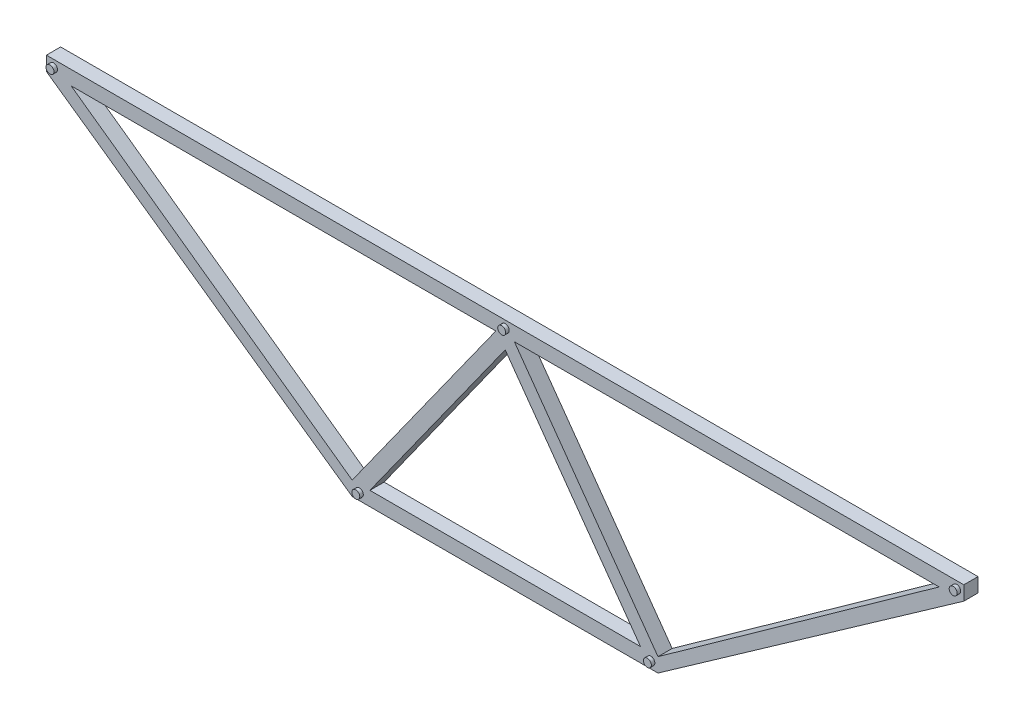
from build123d import *

# Parameters (mm, degrees)
BOSS_EXTRUDE1_DEPTH = 18.59
CUT_EXTRUDE2_DEPTH  = 1238.071375507
SKETCH4_R           = 5.207
BOSS_EXTRUDE3_DEPTH = 23.2


with BuildPart() as part:
    # Sketch2 → Boss-Extrude1 (new body)
    with BuildSketch(Plane.XY):
        Polygon((0, 0), (1200, 0), (1200, -18.59), (800, -300), (400, -300), (0, -18.59), align=None)
    extrude(amount=BOSS_EXTRUDE1_DEPTH)

    # Sketch3 → Cut-Extrude2 (cut, through all)
    with BuildSketch(Plane.XY.offset(18.59)):
        Polygon((32.308203874, -18.59), (400, -281.41), (587.859378773, -18.59), align=None)
        Polygon((600.156298082, -33.792330813), (423.163293339, -281.41), (777.149302825, -281.41), align=None)
        Polygon((800, -281.41), (1167.691796126, -18.59), (612.140621227, -18.59), align=None)
    extrude(amount=-CUT_EXTRUDE2_DEPTH, mode=Mode.SUBTRACT)

    # Sketch4 → Boss-Extrude3 (add)
    with BuildSketch(Plane(origin=(0, 0, 0), x_dir=(-1, 0, 0), z_dir=(0, 0, -1))):
        with Locations((-1190.705, -9.295)):
            Circle(SKETCH4_R)
        with Locations((-600.156298082, -9.295)):
            Circle(SKETCH4_R)
        with Locations((-9.295, -9.295)):
            Circle(SKETCH4_R)
        with Locations((-790.705, -290.705)):
            Circle(SKETCH4_R)
        with Locations((-409.295, -290.705)):
            Circle(SKETCH4_R)
    extrude(amount=-BOSS_EXTRUDE3_DEPTH)


solid = part.part
